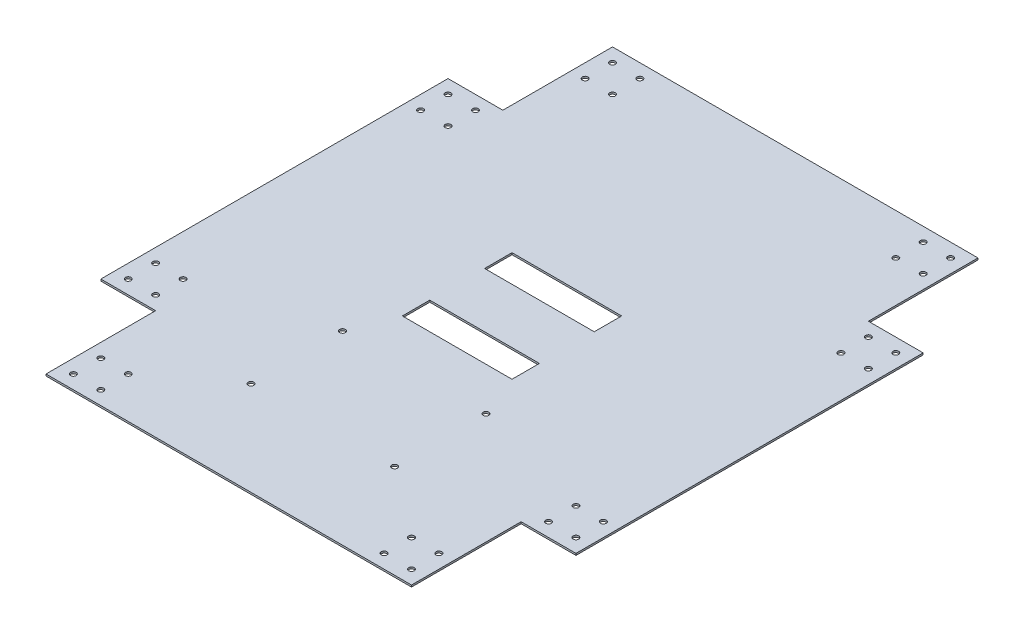
from build123d import *

# Parameters (mm, degrees)
SKETCH_1_R      = 3.1
SKETCH_1_W      = 167
SKETCH_1_H      = 146
EXTRUDE_1_DEPTH = 2


with BuildPart() as part:
    # 草图1 → 凸台-拉伸1 (new body)
    # profile 1 of 4: a face of its own
    with BuildSketch(Plane(origin=(0, 0, 0), x_dir=(1, 0, 0), z_dir=(0, 1, 0))):
        Polygon((-154.747658954, 153.385197935), (-154.747658954, 33.385197935), (-214.747658954, 33.385197935), (-214.747658954, -126.614802065), (-14.747658954, -126.614802065), (-14.747658954, -96.614802065), (105.252341046, -96.614802065), (105.252341046, -126.614802065), (305.252341046, -126.614802065), (305.252341046, 33.385197935), (245.252341046, 33.385197935), (245.252341046, 153.385197935), align=None)
        with Locations(Location((-199.747658954, -11.614802065, 0), (0, 0, 270))):
            Circle(SKETCH_1_R, mode=Mode.SUBTRACT)
        with Locations(Location((-169.747658954, -11.614802065, 0), (0, 0, 270))):
            Circle(SKETCH_1_R, mode=Mode.SUBTRACT)
        with Locations(Location((-199.747658954, 18.385197935, 0), (0, 0, 270))):
            Circle(SKETCH_1_R, mode=Mode.SUBTRACT)
        with Locations(Location((-169.747658954, 18.385197935, 0), (0, 0, 270))):
            Circle(SKETCH_1_R, mode=Mode.SUBTRACT)
        with Locations(Location((-139.747658954, 108.385197935, 0), (0, 0, 270))):
            Circle(SKETCH_1_R, mode=Mode.SUBTRACT)
        with Locations(Location((-109.747658954, 108.385197935, 0), (0, 0, 270))):
            Circle(SKETCH_1_R, mode=Mode.SUBTRACT)
        with Locations(Location((-139.747658954, 138.385197935, 0), (0, 0, 270))):
            Circle(SKETCH_1_R, mode=Mode.SUBTRACT)
        with Locations(Location((-109.747658954, 138.385197935, 0), (0, 0, 270))):
            Circle(SKETCH_1_R, mode=Mode.SUBTRACT)
        with Locations(Location((260.252341046, -11.614802065, 0), (0, 0, 270))):
            Circle(SKETCH_1_R, mode=Mode.SUBTRACT)
        with Locations(Location((290.252341046, -11.614802065, 0), (0, 0, 270))):
            Circle(SKETCH_1_R, mode=Mode.SUBTRACT)
        with Locations(Location((260.252341046, 18.385197935, 0), (0, 0, 270))):
            Circle(SKETCH_1_R, mode=Mode.SUBTRACT)
        with Locations(Location((290.252341046, 18.385197935, 0), (0, 0, 270))):
            Circle(SKETCH_1_R, mode=Mode.SUBTRACT)
        with Locations(Location((200.252341046, 108.385197935, 0), (0, 0, 270))):
            Circle(SKETCH_1_R, mode=Mode.SUBTRACT)
        with Locations(Location((230.252341046, 108.385197935, 0), (0, 0, 270))):
            Circle(SKETCH_1_R, mode=Mode.SUBTRACT)
        with Locations(Location((200.252341046, 138.385197935, 0), (0, 0, 270))):
            Circle(SKETCH_1_R, mode=Mode.SUBTRACT)
        with Locations(Location((230.252341046, 138.385197935, 0), (0, 0, 270))):
            Circle(SKETCH_1_R, mode=Mode.SUBTRACT)
    # profile 2 of 4: a face of its own
    with BuildSketch(Plane(origin=(0, 0, 0), x_dir=(1, 0, 0), z_dir=(0, 1, 0))):
        Polygon((-14.747658954, -186.614802065), (-214.747658954, -186.614802065), (-214.747658954, -346.614802065), (-154.747658954, -346.614802065), (-154.747658954, -466.614802065), (245.252341046, -466.614802065), (245.252341046, -346.614802065), (305.252341046, -346.614802065), (305.252341046, -186.614802065), (105.252341046, -186.614802065), (105.252341046, -216.614802065), (-14.747658954, -216.614802065), align=None)
        with Locations(Location((-139.747658954, -451.614802065, 0), (0, 0, 270))):
            Circle(SKETCH_1_R, mode=Mode.SUBTRACT)
        with Locations(Location((-109.747658954, -451.614802065, 0), (0, 0, 270))):
            Circle(SKETCH_1_R, mode=Mode.SUBTRACT)
        with Locations(Location((-139.747658954, -421.614802065, 0), (0, 0, 270))):
            Circle(SKETCH_1_R, mode=Mode.SUBTRACT)
        with Locations(Location((-109.747658954, -421.614802065, 0), (0, 0, 270))):
            Circle(SKETCH_1_R, mode=Mode.SUBTRACT)
        with Locations(Location((-199.747658954, -331.614802065, 0), (0, 0, 270))):
            Circle(SKETCH_1_R, mode=Mode.SUBTRACT)
        with Locations(Location((-169.747658954, -331.614802065, 0), (0, 0, 270))):
            Circle(SKETCH_1_R, mode=Mode.SUBTRACT)
        with Locations(Location((-199.747658954, -301.614802065, 0), (0, 0, 270))):
            Circle(SKETCH_1_R, mode=Mode.SUBTRACT)
        with Locations(Location((-169.747658954, -301.614802065, 0), (0, 0, 270))):
            Circle(SKETCH_1_R, mode=Mode.SUBTRACT)
        with Locations((45.252341046, -313.614802065)):
            Rectangle(SKETCH_1_W, SKETCH_1_H, mode=Mode.SUBTRACT)
        with Locations(Location((200.252341046, -451.614802065, 0), (0, 0, 270))):
            Circle(SKETCH_1_R, mode=Mode.SUBTRACT)
        with Locations(Location((230.252341046, -451.614802065, 0), (0, 0, 270))):
            Circle(SKETCH_1_R, mode=Mode.SUBTRACT)
        with Locations(Location((200.252341046, -421.614802065, 0), (0, 0, 270))):
            Circle(SKETCH_1_R, mode=Mode.SUBTRACT)
        with Locations(Location((230.252341046, -421.614802065, 0), (0, 0, 270))):
            Circle(SKETCH_1_R, mode=Mode.SUBTRACT)
        with Locations(Location((260.252341046, -331.614802065, 0), (0, 0, 270))):
            Circle(SKETCH_1_R, mode=Mode.SUBTRACT)
        with Locations(Location((290.252341046, -331.614802065, 0), (0, 0, 270))):
            Circle(SKETCH_1_R, mode=Mode.SUBTRACT)
        with Locations(Location((260.252341046, -301.614802065, 0), (0, 0, 270))):
            Circle(SKETCH_1_R, mode=Mode.SUBTRACT)
        with Locations(Location((290.252341046, -301.614802065, 0), (0, 0, 270))):
            Circle(SKETCH_1_R, mode=Mode.SUBTRACT)
    # profile 3 of 4: a face of its own
    with BuildSketch(Plane(origin=(0, 0, 0), x_dir=(1, 0, 0), z_dir=(0, 1, 0))):
        Polygon((-14.747658954, -126.614802065), (-214.747658954, -126.614802065), (-214.747658954, -186.614802065), (-14.747658954, -186.614802065), (105.252341046, -186.614802065), (305.252341046, -186.614802065), (305.252341046, -126.614802065), (105.252341046, -126.614802065), align=None)
    # profile 4 of 4: a face of its own
    with BuildSketch(Plane(origin=(0, 0, 0), x_dir=(1, 0, 0), z_dir=(0, 1, 0))):
        with Locations((45.252341046, -313.614802065)):
            Rectangle(SKETCH_1_W, SKETCH_1_H)
        with Locations(Location((123.752341046, -263.614802065, 0), (0, 0, 270))):
            Circle(SKETCH_1_R, mode=Mode.SUBTRACT)
        with Locations(Location((-33.247658954, -363.614802065, 0), (0, 0, 270))):
            Circle(SKETCH_1_R, mode=Mode.SUBTRACT)
        with Locations(Location((-33.247658954, -263.614802065, 0), (0, 0, 270))):
            Circle(SKETCH_1_R, mode=Mode.SUBTRACT)
        with Locations(Location((123.752341046, -363.614802065, 0), (0, 0, 270))):
            Circle(SKETCH_1_R, mode=Mode.SUBTRACT)
    extrude(amount=EXTRUDE_1_DEPTH)


solid = part.part
